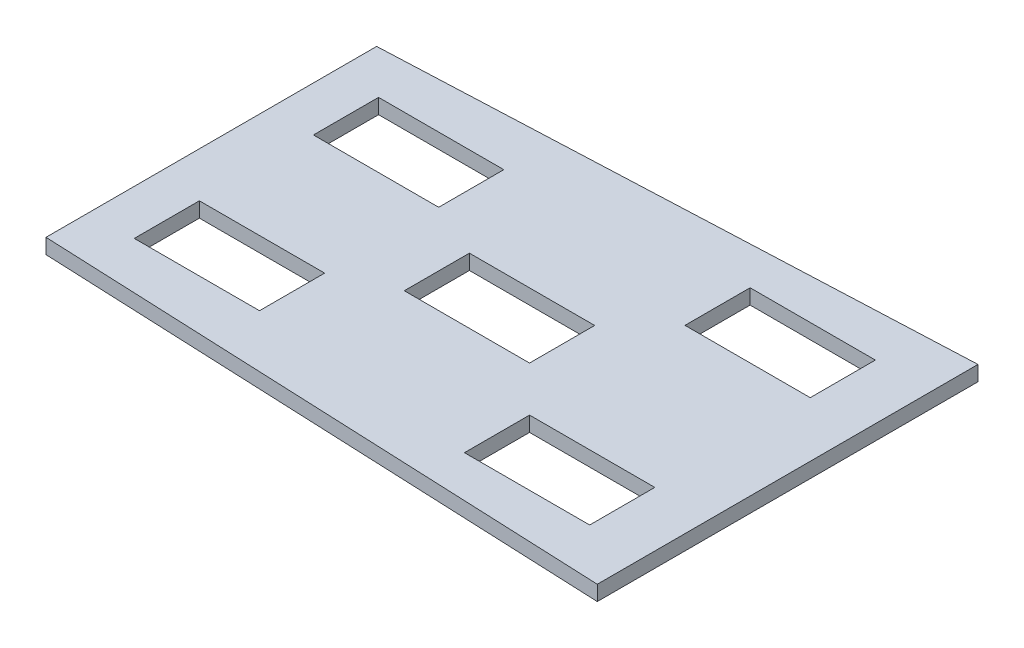
from build123d import *

# Parameters (mm, degrees)
BOSS_EXTRUDE1_DEPTH = 3
SKETCH2_W           = 25
SKETCH2_H           = 13
CUT_EXTRUDE1_DEPTH  = 3


with BuildPart() as part:
    # Sketch1 → Boss-Extrude1 (new body)
    with BuildSketch(Plane(origin=(0, 0, 0), x_dir=(1, 0, 0), z_dir=(0, 1, 0))):
        Polygon((-57.5, -33.023654191), (57.5, -37.976345809), (57.5, 38.023654191), (-57.5, 32.976345809), align=None)
    extrude(amount=BOSS_EXTRUDE1_DEPTH)

    # Sketch2 → Cut-Extrude1 (cut)
    with BuildSketch(Plane(origin=(0, 3, 0), x_dir=(1, 0, 0), z_dir=(0, 1, 0))):
        with Locations((34, -21.994267552)):
            Rectangle(SKETCH2_W, SKETCH2_H)
        Rectangle(SKETCH2_W, SKETCH2_H)
        with Locations((-36, -17.902913606)):
            Rectangle(SKETCH2_W, SKETCH2_H)
        with Locations((-36, 17.862688371)):
            Rectangle(SKETCH2_W, SKETCH2_H)
        with Locations((34, 22.032203991)):
            Rectangle(SKETCH2_W, SKETCH2_H)
    extrude(amount=-CUT_EXTRUDE1_DEPTH, mode=Mode.SUBTRACT)


solid = part.part
